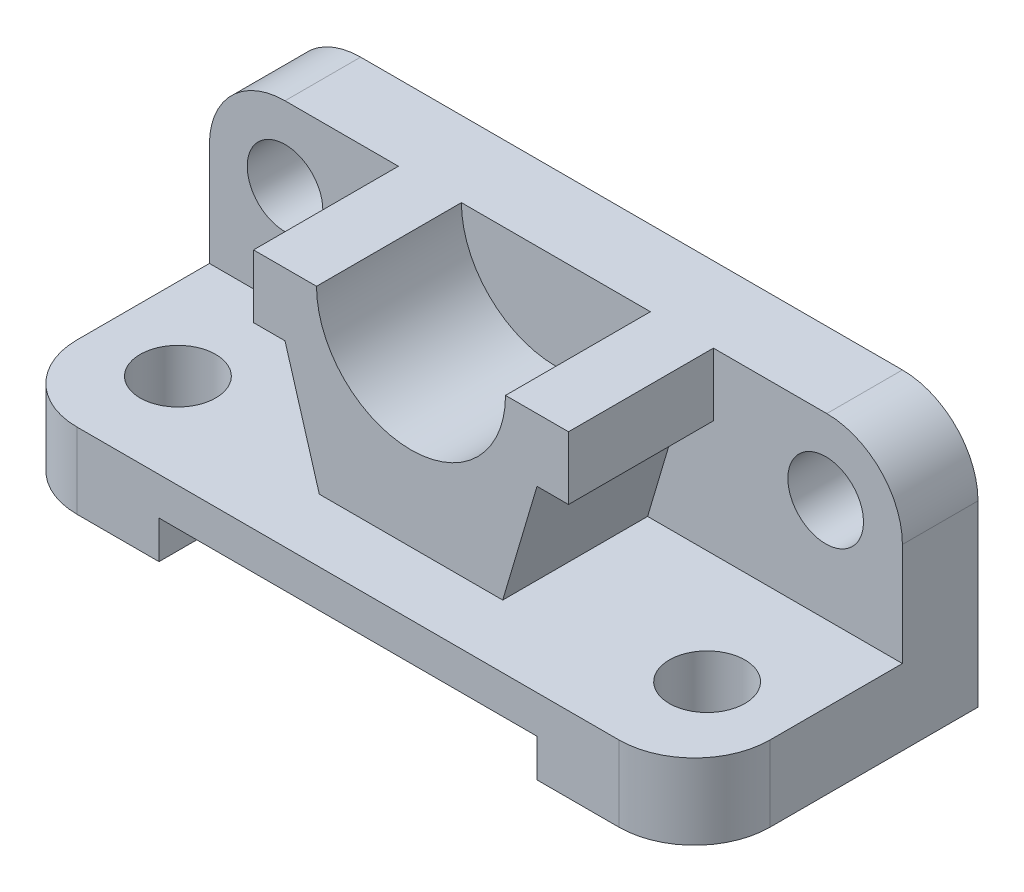
from build123d import *

# Parameters (mm, degrees)
SKETCH1_W           = 110
SKETCH1_H           = 45
BOSS_EXTRUDE1_DEPTH = 12
FILLET1_R           = 12
SKETCH2_W           = 110
SKETCH2_H           = 28.361012769
BOSS_EXTRUDE2_DEPTH = 12
FILLET2_R           = 12
BOSS_EXTRUDE3_DEPTH = 23
SKETCH4_R           = 6
CUT_EXTRUDE1_DEPTH  = 66.845250742
SKETCH5_R           = 6
CUT_EXTRUDE2_DEPTH  = 76.782658648
SKETCH6_W           = 60
SKETCH6_H           = 6
CUT_EXTRUDE3_DEPTH  = 82.725218579


with BuildPart() as part:
    # Sketch1 → Boss-Extrude1 (new body)
    with BuildSketch(Plane(origin=(0, 0, 0), x_dir=(1, 0, 0), z_dir=(0, 1, 0))):
        Rectangle(SKETCH1_W, SKETCH1_H)
    extrude(amount=BOSS_EXTRUDE1_DEPTH)

    # Fillet1
    fillet1_edges = [part.edges().sort_by_distance(p)[0] for p in [
        (55, 6, 22.5),
        (-55, 6, 22.5),
    ]]
    fillet(fillet1_edges, radius=FILLET1_R)

    # Sketch2 → Boss-Extrude2 (add)
    with BuildSketch(Plane(origin=(0, 0, -22.5), x_dir=(-1, 0, 0), z_dir=(0, 0, -1))):
        with Locations((0, 26.180506385)):
            Rectangle(SKETCH2_W, SKETCH2_H)
    extrude(amount=-BOSS_EXTRUDE2_DEPTH)

    # Fillet2
    fillet2_edges = [part.edges().sort_by_distance(p)[0] for p in [
        (55, 40.361012769, -16.5),
        (-55, 40.361012769, -16.5),
    ]]
    fillet(fillet2_edges, radius=FILLET2_R)

    # Sketch3 → Boss-Extrude3 (add)
    with BuildSketch(Plane.XY.offset(-10.5)):
        with BuildLine():
            Line((15, 40.361012769), (25, 40.361012769))
            Line((25, 40.361012769), (25, 30.361012769))
            Line((25, 30.361012769), (20, 30.361012769))
            Line((20, 30.361012769), (11, 0))
            Line((11, 0), (-11, 0))
            Line((-11, 0), (-20, 30.361012769))
            Line((-20, 30.361012769), (-25, 30.361012769))
            Line((-25, 30.361012769), (-25, 40.361012769))
            Line((-25, 40.361012769), (-15, 40.361012769))
            ThreePointArc((-15, 40.361012769), (0, 25.361012769), (15, 40.361012769))
        make_face()
    extrude(amount=BOSS_EXTRUDE3_DEPTH)

    # Sketch4 → Cut-Extrude1 (cut, through all)
    with BuildSketch(Plane(origin=(0, 12, 0), x_dir=(1, 0, 0), z_dir=(0, 1, 0))):
        with Locations(Location((-42, -7.5, 0), (0, 0, 270))):
            Circle(SKETCH4_R)
        with Locations(Location((42, -7.5, 0), (0, 0, 270))):
            Circle(SKETCH4_R)
    extrude(amount=-CUT_EXTRUDE1_DEPTH, mode=Mode.SUBTRACT)

    # Sketch5 → Cut-Extrude2 (cut, through all)
    with BuildSketch(Plane.XY.offset(-10.5)):
        with Locations((-43, 28.361012769)):
            Circle(SKETCH5_R)
        with Locations(Location((42.820569124, 28.361012769, 0), (0, 0, 180))):
            Circle(SKETCH5_R)
    extrude(amount=-CUT_EXTRUDE2_DEPTH, mode=Mode.SUBTRACT)

    # Sketch6 → Cut-Extrude3 (cut, through all)
    with BuildSketch(Plane.XY.offset(22.5)):
        with Locations((0, 3)):
            Rectangle(SKETCH6_W, SKETCH6_H)
    extrude(amount=-CUT_EXTRUDE3_DEPTH, mode=Mode.SUBTRACT)


solid = part.part
